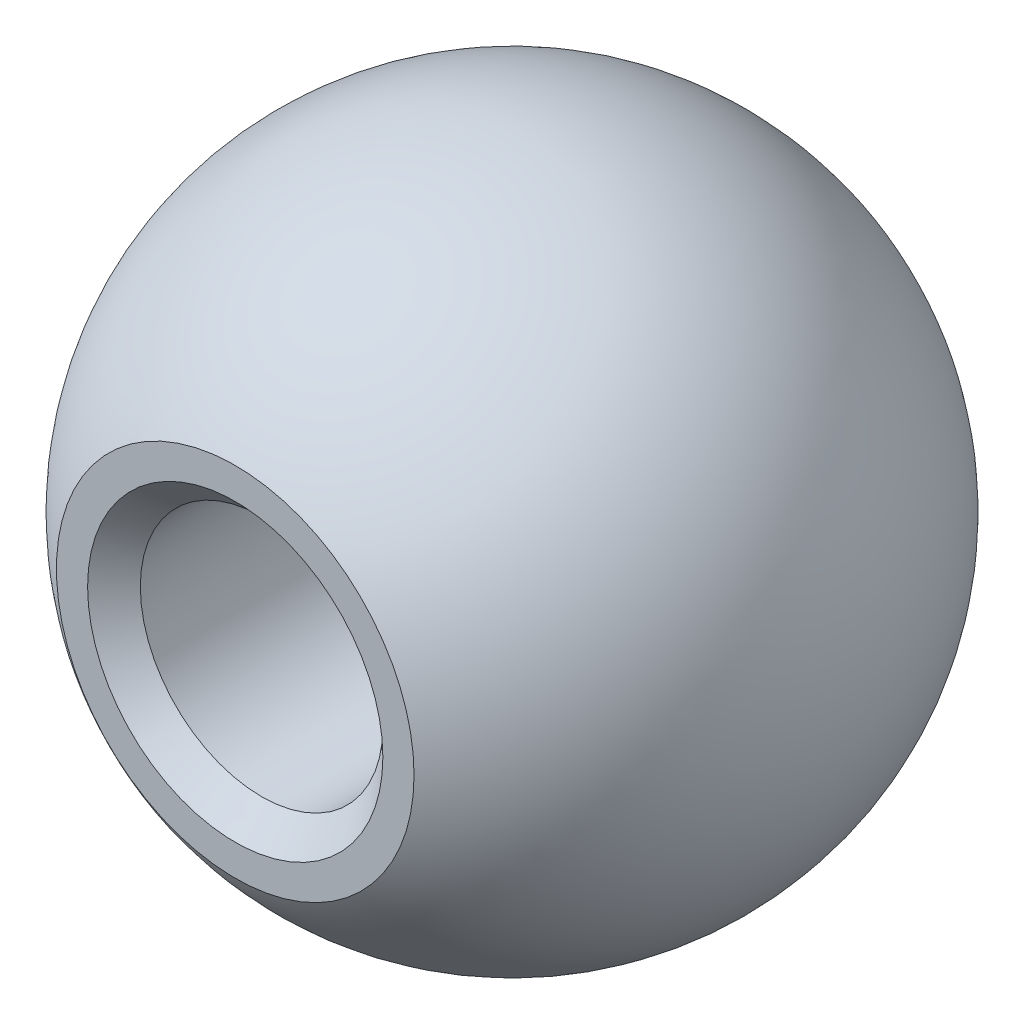
from build123d import *

# Parameters (mm, degrees)
SKETCH2_R                   = 20
CUT_EXTRUDE1_DEPTH          = 2
M10X0_75_TAPPED_HOLE1_D     = 9.2
M10X0_75_TAPPED_HOLE1_DEPTH = 12
M10X0_75_TAPPED_HOLE1_TIP   = 2.763958848
CHAMFER1_SIZE               = 1


with BuildPart() as part:
    # Sketch1 → Revolve1 (revolve)
    with BuildSketch(Plane.XY):
        with BuildLine():
            Line((0, 12.5), (0, -12.5))
            ThreePointArc((0, -12.5), (-12.5, 0), (0, 12.5))
        make_face()
    revolve(axis=Axis((0, 12.5, 0), (0, -1, 0)))

    # Sketch2 → Cut-Extrude1 (cut)
    with BuildSketch(Plane.XY.offset(12.5)):
        Circle(SKETCH2_R)
    extrude(amount=-CUT_EXTRUDE1_DEPTH, mode=Mode.SUBTRACT)

    # M10x0.75 Tapped Hole1
    with Locations(Plane.XY.offset(10.5)):
        with Locations((0, 0)):
            Hole(M10X0_75_TAPPED_HOLE1_D / 2, depth=M10X0_75_TAPPED_HOLE1_DEPTH)
            with Locations((0, 0, -(M10X0_75_TAPPED_HOLE1_DEPTH + M10X0_75_TAPPED_HOLE1_TIP / 2))):  # 118° drill point
                Cone(0, M10X0_75_TAPPED_HOLE1_D / 2, M10X0_75_TAPPED_HOLE1_TIP, mode=Mode.SUBTRACT)

    # Chamfer1
    chamfer1_edges = [part.edges().sort_by_distance(p)[0] for p in [
        (4.6, 0, 10.5),
    ]]
    chamfer(chamfer1_edges, length=CHAMFER1_SIZE)


solid = part.part
